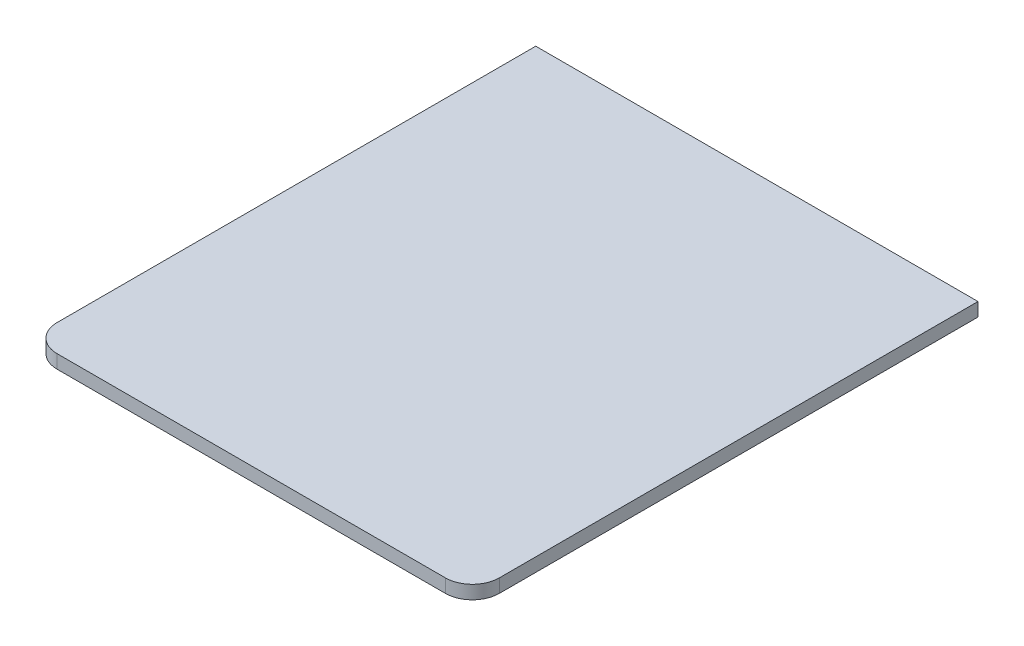
from build123d import *

# Parameters (mm, degrees)
SKETCH_1_W      = 32.8
SKETCH_1_H      = 37.5
EXTRUDE_1_DEPTH = 1
FILLET_1_R      = 2


with BuildPart() as part:
    # 草图1 → 凸台-拉伸1 (new body)
    with BuildSketch(Plane(origin=(0, 0, 0), x_dir=(1, 0, 0), z_dir=(0, 1, 0))):
        with Locations((16.4, 18.75)):
            Rectangle(SKETCH_1_W, SKETCH_1_H)
    extrude(amount=-EXTRUDE_1_DEPTH)

    # 圆角1
    fillet_1_edges = [part.edges().sort_by_distance(p)[0] for p in [
        (32.8, -0.5, 0),
        (0, -0.5, 0),
    ]]
    fillet(fillet_1_edges, radius=FILLET_1_R)


solid = part.part
